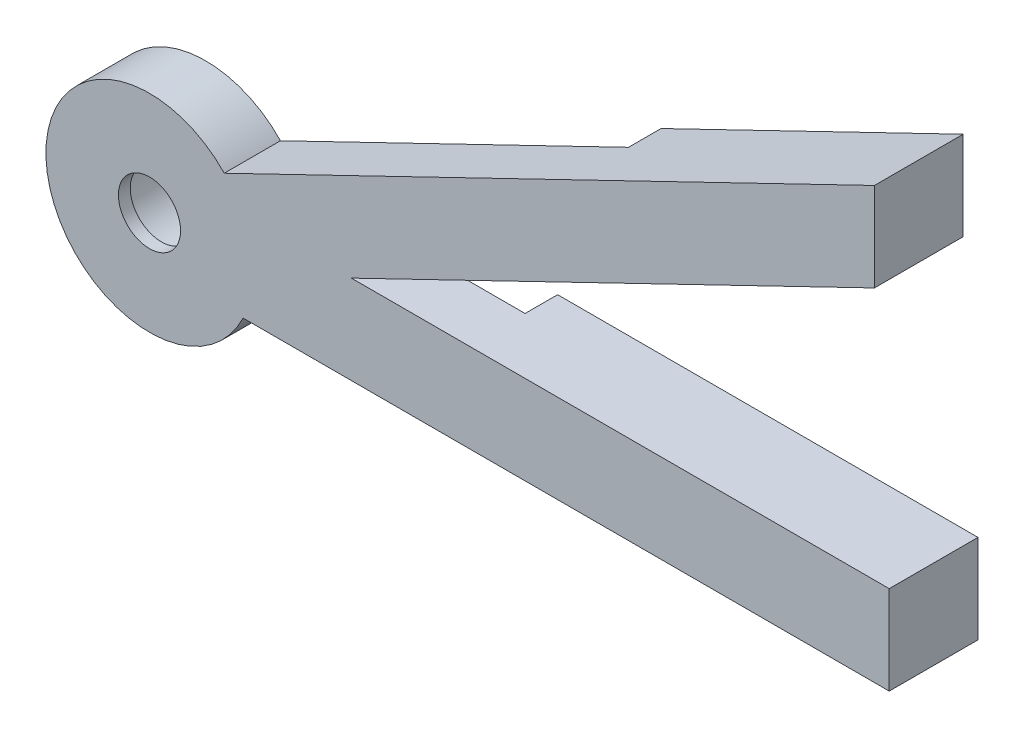
from build123d import *

# Parameters (mm, degrees)
BOSS_EXTRUDE2_DEPTH   = 6
BOSS_EXTRUDE2_2_DEPTH = 6
SKETCH1_3_R           = 2.1
BOSS_EXTRUDE3_DEPTH   = 3.8
SKETCH3_R             = 3.1
CUT_EXTRUDE2_DEPTH    = 3


with BuildPart() as part:
    # Sketch1 → Boss-Extrude2 (new body)
    with BuildSketch(Plane(origin=(0, 0, 0), x_dir=(-1, 0, 0), z_dir=(0, 0, 1))):
        Polygon((9.209773359, -16.292309171), (-15.475780333, -28.232378111), (-15.475780333, -34.232378111), (4.947252827, -24.354032787), align=None)
    extrude(amount=-BOSS_EXTRUDE2_DEPTH)



with BuildPart() as body_2:
    # Sketch1 → Boss-Extrude2 2 (new body)
    with BuildSketch(Plane(origin=(0, 0, 0), x_dir=(-1, 0, 0), z_dir=(0, 0, 1))):
        with BuildLine():
            Line((-16.475780333, -11.132378111), (11.93801277, -11.132378111))
            Line((11.93801277, -11.132378111), (13.524219667, -8.132378111))
            ThreePointArc((13.524219667, -8.132378111), (13.580869915, -6.628117273), (13.750499733, -5.132378111))
            Line((13.750499733, -5.132378111), (-16.475780333, -5.132378111))
            Line((-16.475780333, -5.132378111), (-16.475780333, -11.132378111))
        make_face()
    extrude(amount=-BOSS_EXTRUDE2_2_DEPTH)


with BuildPart() as part_1:
    add(part.part)

    add(body_2.part)  # Boss-Extrude3 merges body 2
    # Sketch1<3> → Boss-Extrude3 (add)
    with BuildSketch(Plane(origin=(0, 0, 0), x_dir=(-1, 0, 0), z_dir=(0, 0, 1))):
        with BuildLine():
            Line((19.877697964, -11.132378111), (9.209773359, -16.292309171))
            Line((9.209773359, -16.292309171), (4.947252827, -24.354032787))
            Line((4.947252827, -24.354032787), (28.470653106, -12.976081758))
            ThreePointArc((28.470653106, -12.976081758), (40.434092032, -7.012706779), (27.199664346, -5.132378111))
            Line((27.199664346, -5.132378111), (13.750499733, -5.132378111))
            ThreePointArc((13.750499733, -5.132378111), (13.580869915, -6.628117273), (13.524219667, -8.132378111))
            Line((13.524219667, -8.132378111), (11.93801277, -11.132378111))
            Line((11.93801277, -11.132378111), (19.877697964, -11.132378111))
        make_face()
        with Locations((33.524219667, -8.132378111)):
            Circle(SKETCH1_3_R, mode=Mode.SUBTRACT)
    extrude(amount=-BOSS_EXTRUDE3_DEPTH)

    # Sketch3 → Cut-Extrude2 (cut)
    with BuildSketch(Plane(origin=(0, 0, -3.8), x_dir=(-1, 0, 0), z_dir=(0, 0, -1))):
        with Locations((33.524219667, 8.132378111)):
            Circle(SKETCH3_R)
    extrude(amount=-CUT_EXTRUDE2_DEPTH, mode=Mode.SUBTRACT)


solid = part_1.part
